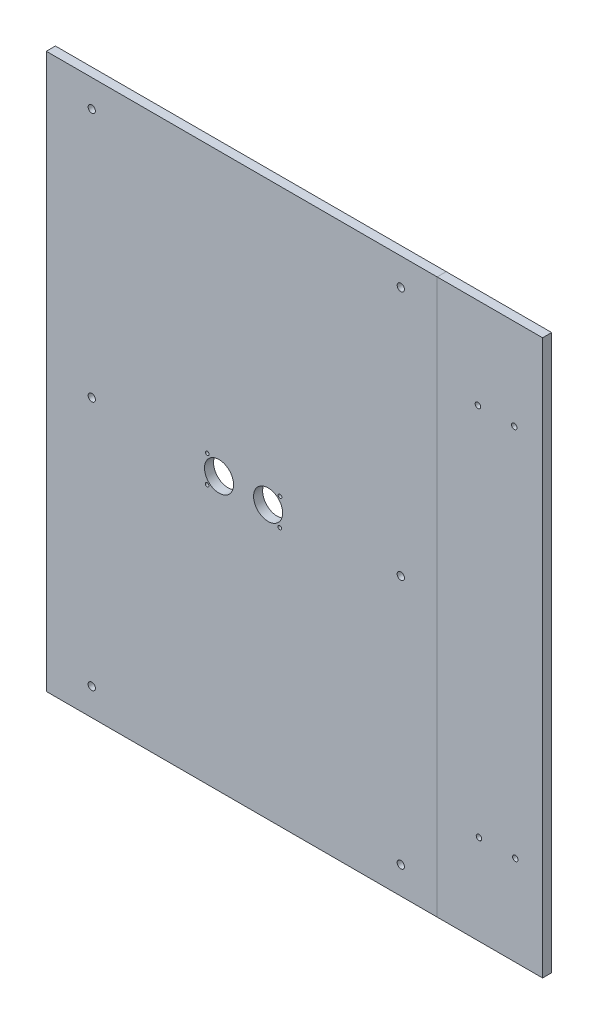
from build123d import *

# Parameters (mm, degrees)
ESQUISSE1_W             = 215
ESQUISSE1_H             = 305
BOSS_EXTRU_1_DEPTH      = 5
ESQUISSE2_R             = 2
ENL_V_MAT_EXTRU_1_DEPTH = 5
ESQUISSE3_W             = 58
ESQUISSE3_H             = 305
BOSS_EXTRU_2_DEPTH      = 5
ESQUISSE4_R             = 1.5
ENL_V_MAT_EXTRU_3_DEPTH = 410.364141077
ESQUISSE5_R             = 1.5
ENL_V_MAT_EXTRU_4_DEPTH = 410.364141077
ESQUISSE6_R             = 8
ENL_V_MAT_EXTRU_5_DEPTH = 410.364141077
ESQUISSE7_R             = 1
ENL_V_MAT_EXTRU_7_DEPTH = 410.364141077


with BuildPart() as part:
    # Esquisse1 → Boss.-Extru.1 (new body)
    with BuildSketch(Plane.XY):
        with Locations((107.5, 152.5)):
            Rectangle(ESQUISSE1_W, ESQUISSE1_H)
    extrude(amount=BOSS_EXTRU_1_DEPTH)

    # Esquisse2 → Enlèv. mat.-Extru.1 (cut)
    with BuildSketch(Plane(origin=(0, 0, 0), x_dir=(-1, 0, 0), z_dir=(0, 0, -1))):
        with Locations((-195, 290)):
            Circle(ESQUISSE2_R)
        with Locations((-25, 290)):
            Circle(ESQUISSE2_R)
        with Locations((-25, 15)):
            Circle(ESQUISSE2_R)
        with Locations((-195, 15)):
            Circle(ESQUISSE2_R)
        with Locations((-195, 152.5)):
            Circle(ESQUISSE2_R)
        with Locations((-25, 152.5)):
            Circle(ESQUISSE2_R)
    extrude(amount=-ENL_V_MAT_EXTRU_1_DEPTH, mode=Mode.SUBTRACT)

    # Esquisse6 → Enlèv. mat.-Extru.5 (cut, through all)
    with BuildSketch(Plane(origin=(0, 0, 0), x_dir=(-1, 0, 0), z_dir=(0, 0, -1))):
        with Locations((-122, 150)):
            Circle(ESQUISSE6_R)
        with Locations((-95, 150)):
            Circle(ESQUISSE6_R)
    extrude(amount=-ENL_V_MAT_EXTRU_5_DEPTH, mode=Mode.SUBTRACT)

    # Esquisse7 → Enlèv. mat.-Extru.7 (cut, through all)
    with BuildSketch(Plane(origin=(0, 0, 0), x_dir=(-1, 0, 0), z_dir=(0, 0, -1))):
        with Locations((-128.548036325, 157.285475877)):
            Circle(ESQUISSE7_R)
        with Locations((-128.451980772, 142.285475877)):
            Circle(ESQUISSE7_R)
        with Locations((-88.548036325, 157.714598257)):
            Circle(ESQUISSE7_R)
        with Locations((-88.451947576, 142.714598257)):
            Circle(ESQUISSE7_R)
    extrude(amount=-ENL_V_MAT_EXTRU_7_DEPTH, mode=Mode.SUBTRACT)


with BuildPart() as body_2:
    # Esquisse3 → Boss.-Extru.2 (new body)
    with BuildSketch(Plane(origin=(0, 0, 0), x_dir=(-1, 0, 0), z_dir=(0, 0, -1))):
        with Locations((-244, 152.5)):
            Rectangle(ESQUISSE3_W, ESQUISSE3_H)
    extrude(amount=-BOSS_EXTRU_2_DEPTH)

    # Esquisse4 → Enlèv. mat.-Extru.3 (cut, through all)
    with BuildSketch(Plane(origin=(0, 0, 0), x_dir=(-1, 0, 0), z_dir=(0, 0, -1))):
        with Locations((-237.4, 255)):
            Circle(ESQUISSE4_R)
        with Locations((-257.4, 255)):
            Circle(ESQUISSE4_R)
    extrude(amount=-ENL_V_MAT_EXTRU_3_DEPTH, mode=Mode.SUBTRACT)

    # Esquisse5 → Enlèv. mat.-Extru.4 (cut, through all)
    with BuildSketch(Plane.XY.offset(5)):
        with Locations((238, 49.5)):
            Circle(ESQUISSE5_R)
        with Locations((258, 49.5)):
            Circle(ESQUISSE5_R)
    extrude(amount=-ENL_V_MAT_EXTRU_4_DEPTH, mode=Mode.SUBTRACT)


solid = Compound([part.part, body_2.part])
